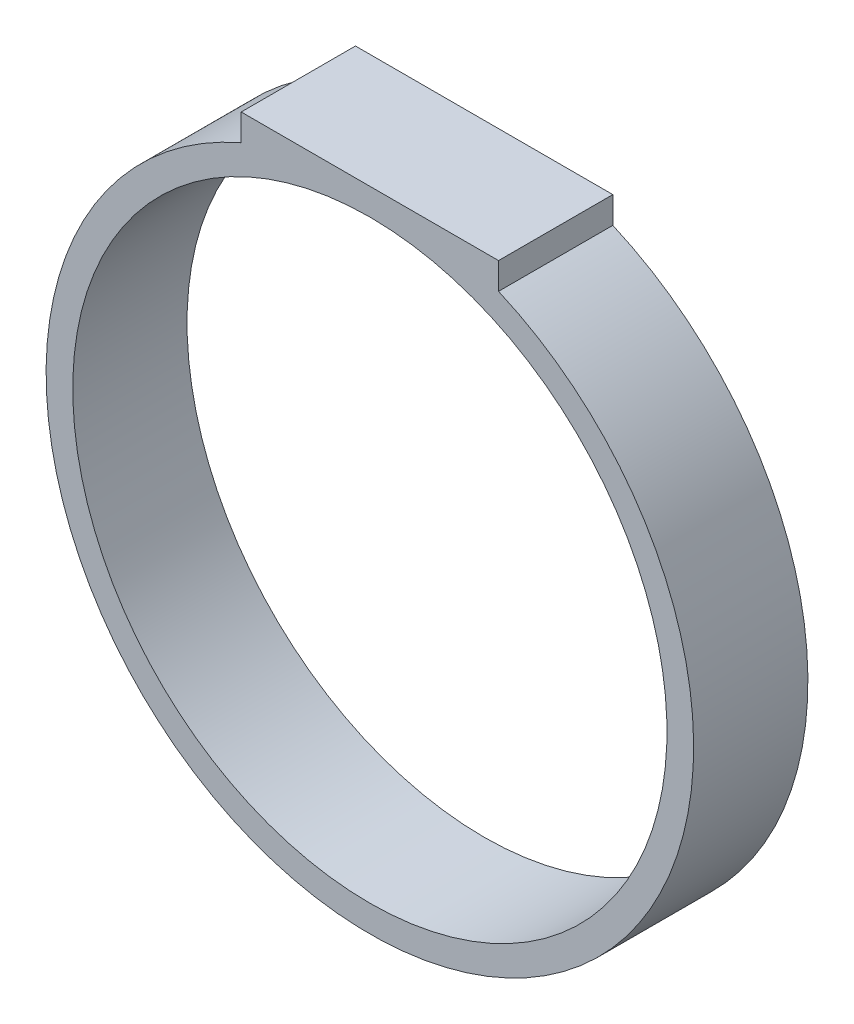
from build123d import *

# Parameters (mm, degrees)
IZIM1_R                     = 85
IZIM1_R_2                   = 78
Y_KSEKLIK_EKSTR_ZYON1_DEPTH = 15
IZIM2_W                     = 67.56
IZIM2_H                     = 7.000566669
Y_KSEKLIK_EKSTR_ZYON2_DEPTH = 30


with BuildPart() as part:
    # Çizim1 → Yükseklik-Ekstrüzyon1 (new, symmetric)
    with BuildSketch(Plane.XY):
        Circle(IZIM1_R)
        Circle(IZIM1_R_2, mode=Mode.SUBTRACT)
    extrude(amount=Y_KSEKLIK_EKSTR_ZYON1_DEPTH, both=True)

    # Çizim2 → Yükseklik-Ekstrüzyon2 (add)
    with BuildSketch(Plane.XY.offset(15)):
        with Locations((0, 81.499716666)):
            Rectangle(IZIM2_W, IZIM2_H)
    extrude(amount=-Y_KSEKLIK_EKSTR_ZYON2_DEPTH)


solid = part.part
